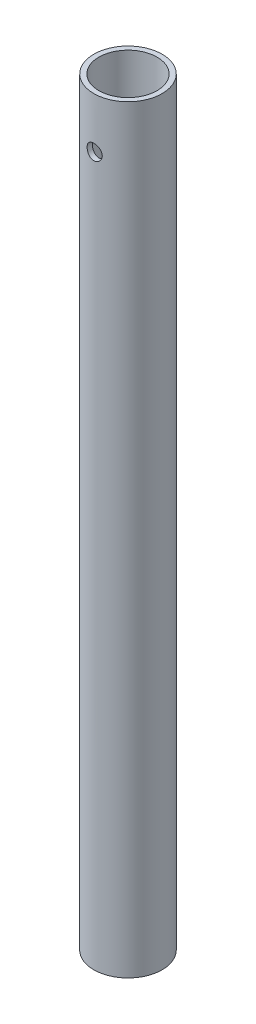
from build123d import *

# Parameters (mm, degrees)
CROQUIS1_R                 = 13.5
SALIENTE_EXTRUIR1_DEPTH    = 300
CROQUIS2_R                 = 3
CORTAR_EXTRUIR1_DEPTH      = 15
CROQUIS4_R                 = 11.5
CORTAR_EXTRUIR4_DEPTH      = 50
CORTAR_EXTRUIR5_DEPTH      = 301.606886149
CORTAR_EXTRUIR5_DEPTH_BACK = 301.606886149
CROQUIS5_R                 = 3


with BuildPart() as part:
    # Croquis1 → Saliente-Extruir1 (new body)
    with BuildSketch(Plane(origin=(0, 0, 0), x_dir=(1, 0, 0), z_dir=(0, 1, 0))):
        with Locations(Location((0, 0, 0), (0, 0, 270))):
            Circle(CROQUIS1_R)
    extrude(amount=SALIENTE_EXTRUIR1_DEPTH)

    # Croquis2 → Cortar-Extruir1 (cut)
    with BuildSketch(Plane.XZ):
        with Locations(Location((0, 0, 0), (0, 0, 270))):
            Circle(CROQUIS2_R)
    extrude(amount=-CORTAR_EXTRUIR1_DEPTH, mode=Mode.SUBTRACT)

    # Croquis4 → Cortar-Extruir4 (cut)
    with BuildSketch(Plane(origin=(0, 300, 0), x_dir=(1, 0, 0), z_dir=(0, 1, 0))):
        with Locations(Location((0, 0, 0), (0, 0, 270))):
            Circle(CROQUIS4_R)
    extrude(amount=-CORTAR_EXTRUIR4_DEPTH, mode=Mode.SUBTRACT)

    # Croquis5 → Cortar-Extruir5 (cut, two sides: drawn at the far end of the back side and taken through both)
    with BuildSketch(Plane.XY.offset(-CORTAR_EXTRUIR5_DEPTH_BACK)):
        with Locations((0, 280)):
            Circle(CROQUIS5_R)
    extrude(amount=CORTAR_EXTRUIR5_DEPTH + CORTAR_EXTRUIR5_DEPTH_BACK, mode=Mode.SUBTRACT)


solid = part.part
